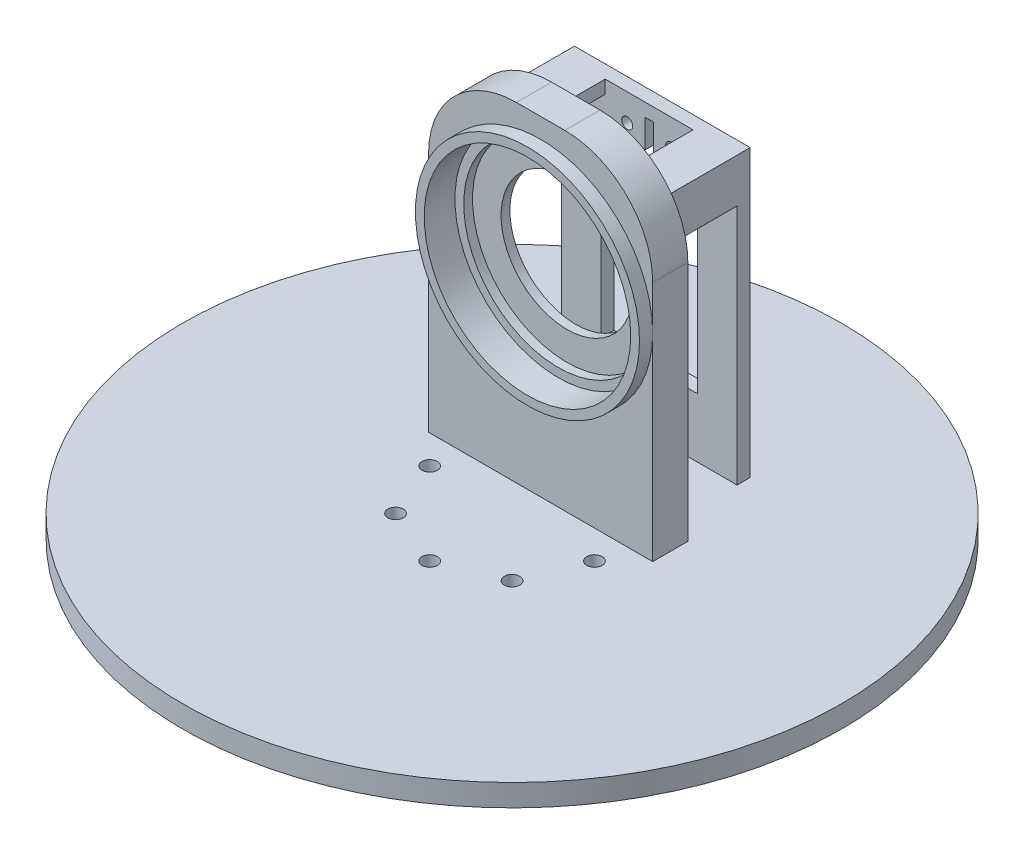
from build123d import *

# Parameters (mm, degrees)
SKETCH_1_R          = 25.5
SKETCH_1_R_2        = 15
EXTRUDE_1_DEPTH     = 2
SKETCH_2_R          = 25.5
SKETCH_2_R_2        = 21.5
EXTRUDE_2_DEPTH     = 2
SKETCH_3_R          = 25.5
SKETCH_3_R_2        = 23.5
EXTRUDE_3_DEPTH     = 7
SKETCH_4_W          = 51
SKETCH_4_H          = 80
SKETCH_4_R          = 23.5
EXTRUDE_4_DEPTH     = 8
FILLET_1_R          = 20
SKETCH_5_W          = 51
SKETCH_5_H          = 5
EXTRUDE_5_DEPTH     = 19.7
SKETCH_6_W          = 40
SKETCH_6_H          = 70
EXTRUDE_6_DEPTH     = 3
CUT_EXTRUDE_1_REACH = 65.975
SKETCH_7_R          = 1.25
SKETCH_8_R          = 75
EXTRUDE_7_DEPTH     = 5
SKETCH_9_R          = 22.5
CUT_EXTRUDE_2_DEPTH = 2
CUT_EXTRUDE_3_REACH = 142.425
SKETCH_10_R         = 1.75


with BuildPart() as part:
    # 스케치1 → 보스-돌출1 (new body)
    with BuildSketch(Plane.XY):
        Circle(SKETCH_1_R)
        Circle(SKETCH_1_R_2, mode=Mode.SUBTRACT)
    extrude(amount=EXTRUDE_1_DEPTH)

    # 스케치2 → 보스-돌출2 (add)
    with BuildSketch(Plane.XY.offset(2)):
        Circle(SKETCH_2_R)
        Circle(SKETCH_2_R_2, mode=Mode.SUBTRACT)
    extrude(amount=EXTRUDE_2_DEPTH)

    # 스케치3 → 보스-돌출3 (add)
    with BuildSketch(Plane.XY.offset(4)):
        Circle(SKETCH_3_R)
        Circle(SKETCH_3_R_2, mode=Mode.SUBTRACT)
    extrude(amount=EXTRUDE_3_DEPTH)

    # 스케치4 → 보스-돌출4 (add)
    with BuildSketch(Plane(origin=(0, 0, 0), x_dir=(-1, 0, 0), z_dir=(0, 0, -1))):
        with Locations((0, -10)):
            Rectangle(SKETCH_4_W, SKETCH_4_H)
        with Locations(Location((0, 0, 0), (0, 0, 180))):
            Circle(SKETCH_4_R, mode=Mode.SUBTRACT)
    extrude(amount=-EXTRUDE_4_DEPTH)

    # 필렛1
    fillet_1_edges = [part.edges().sort_by_distance(p)[0] for p in [
        (-25.5, 30, 4),
        (25.5, 30, 4),
    ]]
    fillet(fillet_1_edges, radius=FILLET_1_R)

    # 스케치5 → 보스-돌출5 (add)
    with BuildSketch(Plane(origin=(0, 0, 0), x_dir=(-1, 0, 0), z_dir=(0, 0, -1))):
        Polygon((-20, 20), (-10, 20), (-10, 17), (-17, 17), (-17, 10), (-20, 10), align=None)
        Polygon((20, 20), (10, 20), (10, 17), (17, 17), (17, 10), (20, 10), align=None)
        with Locations((0, -47.5)):
            Rectangle(SKETCH_5_W, SKETCH_5_H)
    extrude(amount=EXTRUDE_5_DEPTH)

    # 스케치6 → 보스-돌출6 (add)
    with BuildSketch(Plane(origin=(0, 0, -19.7), x_dir=(-1, 0, 0), z_dir=(0, 0, -1))):
        with Locations((0, -15)):
            Rectangle(SKETCH_6_W, SKETCH_6_H)
    extrude(amount=-EXTRUDE_6_DEPTH)

    # 스케치7 → 컷-돌출1 (cut, up to next)
    with BuildSketch(Plane(origin=(0, 0, -19.7), x_dir=(-1, 0, 0), z_dir=(0, 0, -1)), mode=Mode.PRIVATE) as cut_extrude_1_sk1:
        with Locations((-5, 13.85)):
            Circle(SKETCH_7_R)
    cut_extrude_1_tool1 = extrude(cut_extrude_1_sk1.sketch, amount=-CUT_EXTRUDE_1_REACH, mode=Mode.PRIVATE) & part.part
    # 스케치7 → 컷-돌출1 (cut, up to next)
    with BuildSketch(Plane(origin=(0, 0, -19.7), x_dir=(-1, 0, 0), z_dir=(0, 0, -1)), mode=Mode.PRIVATE) as cut_extrude_1_sk2:
        with Locations((5, 13.85)):
            Circle(SKETCH_7_R)
    cut_extrude_1_tool2 = extrude(cut_extrude_1_sk2.sketch, amount=-CUT_EXTRUDE_1_REACH, mode=Mode.PRIVATE) & part.part
    # 스케치7 → 컷-돌출1 (cut, up to next)
    with BuildSketch(Plane(origin=(0, 0, -19.7), x_dir=(-1, 0, 0), z_dir=(0, 0, -1)), mode=Mode.PRIVATE) as cut_extrude_1_sk3:
        with Locations((5, -34.75)):
            Circle(SKETCH_7_R)
    cut_extrude_1_tool3 = extrude(cut_extrude_1_sk3.sketch, amount=-CUT_EXTRUDE_1_REACH, mode=Mode.PRIVATE) & part.part
    # 스케치7 → 컷-돌출1 (cut, up to next)
    with BuildSketch(Plane(origin=(0, 0, -19.7), x_dir=(-1, 0, 0), z_dir=(0, 0, -1)), mode=Mode.PRIVATE) as cut_extrude_1_sk4:
        with Locations((-5, -34.75)):
            Circle(SKETCH_7_R)
    cut_extrude_1_tool4 = extrude(cut_extrude_1_sk4.sketch, amount=-CUT_EXTRUDE_1_REACH, mode=Mode.PRIVATE) & part.part
    # 스케치7 → 컷-돌출1 (cut, up to next)
    with BuildSketch(Plane(origin=(0, 0, -19.7), x_dir=(-1, 0, 0), z_dir=(0, 0, -1)), mode=Mode.PRIVATE) as cut_extrude_1_sk5:
        Polygon((-11, -31.5), (-1, -31.5), (-1, -38), (1, -38), (1, -31.5), (11, -31.5), (11, 10.5), (1, 10.5), (1, 17), (-1, 17), (-1, 10.5), (-11, 10.5), align=None)
    cut_extrude_1_tool5 = extrude(cut_extrude_1_sk5.sketch, amount=-CUT_EXTRUDE_1_REACH, mode=Mode.PRIVATE) & part.part
    add(cut_extrude_1_tool1.solids().sort_by_distance((5, 13.85, -19.7))[0], mode=Mode.SUBTRACT)
    add(cut_extrude_1_tool2.solids().sort_by_distance((-5, 13.85, -19.7))[0], mode=Mode.SUBTRACT)
    add(cut_extrude_1_tool3.solids().sort_by_distance((-5, -34.75, -19.7))[0], mode=Mode.SUBTRACT)
    add(cut_extrude_1_tool4.solids().sort_by_distance((5, -34.75, -19.7))[0], mode=Mode.SUBTRACT)
    add(cut_extrude_1_tool5.solids().sort_by_distance((0, -10.5, -19.7))[0], mode=Mode.SUBTRACT)

    # 스케치8 → 보스-돌출7 (add)
    with BuildSketch(Plane.XZ.offset(50)):
        with Locations(Location((0, 14.5, 0), (0, 0, 270))):
            Circle(SKETCH_8_R)
    extrude(amount=-EXTRUDE_7_DEPTH)

    # 스케치9 → 컷-돌출2 (cut)
    with BuildSketch(Plane.XZ.offset(50)):
        with Locations(Location((0, 14.5, 0), (0, 0, 270))):
            Circle(SKETCH_9_R)
    extrude(amount=-CUT_EXTRUDE_2_DEPTH, mode=Mode.SUBTRACT)

    # 스케치10 → 컷-돌출3 (cut, up to next)
    with BuildSketch(Plane.XZ.offset(48), mode=Mode.PRIVATE) as cut_extrude_3_sk1:
        with Locations(Location((0, 33.25, 0), (0, 0, 270))):
            Circle(SKETCH_10_R)
    cut_extrude_3_tool1 = extrude(cut_extrude_3_sk1.sketch, amount=-CUT_EXTRUDE_3_REACH, mode=Mode.PRIVATE) & part.part
    # 스케치10 → 컷-돌출3 (cut, up to next)
    with BuildSketch(Plane.XZ.offset(48), mode=Mode.PRIVATE) as cut_extrude_3_sk2:
        with Locations(Location((13.258252147, 27.758252147, 0), (0, 0, 270))):
            Circle(SKETCH_10_R)
    cut_extrude_3_tool2 = extrude(cut_extrude_3_sk2.sketch, amount=-CUT_EXTRUDE_3_REACH, mode=Mode.PRIVATE) & part.part
    # 스케치10 → 컷-돌출3 (cut, up to next)
    with BuildSketch(Plane.XZ.offset(48), mode=Mode.PRIVATE) as cut_extrude_3_sk3:
        with Locations(Location((18.75, 14.5, 0), (0, 0, 270))):
            Circle(SKETCH_10_R)
    cut_extrude_3_tool3 = extrude(cut_extrude_3_sk3.sketch, amount=-CUT_EXTRUDE_3_REACH, mode=Mode.PRIVATE) & part.part
    # 스케치10 → 컷-돌출3 (cut, up to next)
    with BuildSketch(Plane.XZ.offset(48), mode=Mode.PRIVATE) as cut_extrude_3_sk4:
        with Locations(Location((0, -4.25, 0), (0, 0, 270))):
            Circle(SKETCH_10_R)
    cut_extrude_3_tool4 = extrude(cut_extrude_3_sk4.sketch, amount=-CUT_EXTRUDE_3_REACH, mode=Mode.PRIVATE) & part.part
    # 스케치10 → 컷-돌출3 (cut, up to next)
    with BuildSketch(Plane.XZ.offset(48), mode=Mode.PRIVATE) as cut_extrude_3_sk5:
        with Locations(Location((-18.75, 14.5, 0), (0, 0, 270))):
            Circle(SKETCH_10_R)
    cut_extrude_3_tool5 = extrude(cut_extrude_3_sk5.sketch, amount=-CUT_EXTRUDE_3_REACH, mode=Mode.PRIVATE) & part.part
    # 스케치10 → 컷-돌출3 (cut, up to next)
    with BuildSketch(Plane.XZ.offset(48), mode=Mode.PRIVATE) as cut_extrude_3_sk6:
        with Locations(Location((-13.258252147, 27.758252147, 0), (0, 0, 270))):
            Circle(SKETCH_10_R)
    cut_extrude_3_tool6 = extrude(cut_extrude_3_sk6.sketch, amount=-CUT_EXTRUDE_3_REACH, mode=Mode.PRIVATE) & part.part
    add(cut_extrude_3_tool1.solids().sort_by_distance((0, -48, 33.25))[0], mode=Mode.SUBTRACT)
    add(cut_extrude_3_tool2.solids().sort_by_distance((13.258252, -48, 27.758252))[0], mode=Mode.SUBTRACT)
    add(cut_extrude_3_tool3.solids().sort_by_distance((18.75, -48, 14.5))[0], mode=Mode.SUBTRACT)
    add(cut_extrude_3_tool4.solids().sort_by_distance((0, -48, -4.25))[0], mode=Mode.SUBTRACT)
    add(cut_extrude_3_tool5.solids().sort_by_distance((-18.75, -48, 14.5))[0], mode=Mode.SUBTRACT)
    add(cut_extrude_3_tool6.solids().sort_by_distance((-13.258252, -48, 27.758252))[0], mode=Mode.SUBTRACT)


solid = part.part
